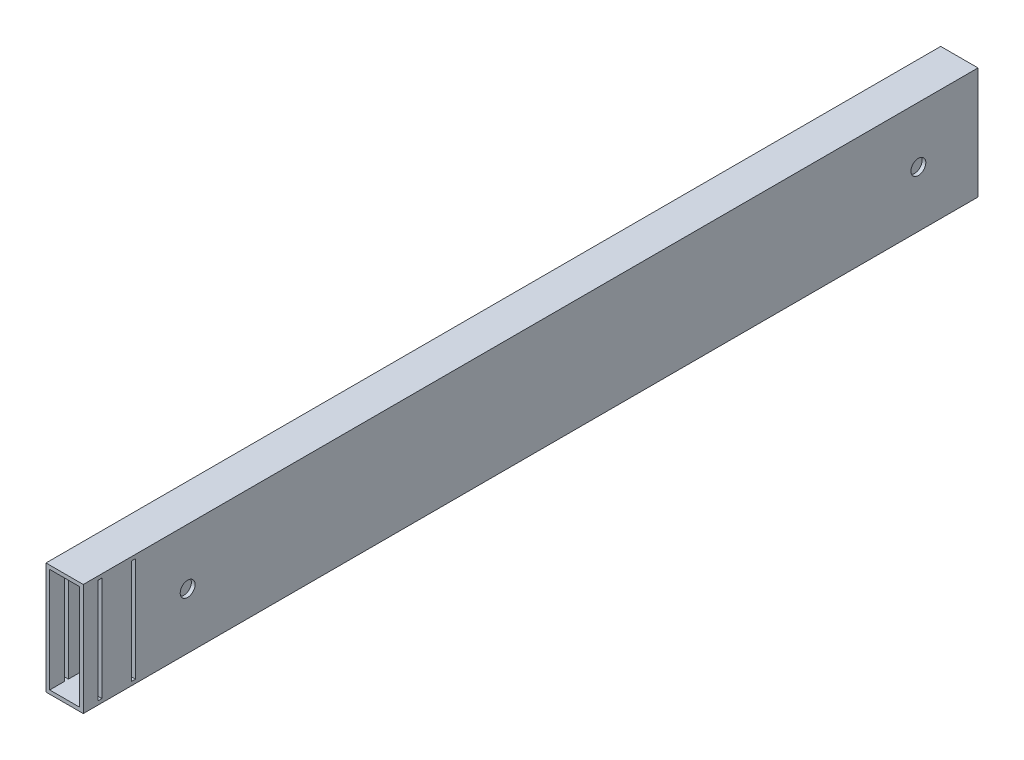
from build123d import *

# Parameters (mm, degrees)
SKETCH1_W           = 50
SKETCH1_H           = 1200
BOSS_EXTRUDE1_DEPTH = 150
CUT_EXTRUDE4_DEPTH  = 1216.781641579
SKETCH18_W          = 5
SKETCH18_H          = 140
CUT_EXTRUDE6_DEPTH  = 944.345111823
SKETCH19_W          = 5
SKETCH19_H          = 140
CUT_EXTRUDE7_DEPTH  = 944.345111823
SKETCH20_R          = 10
CUT_EXTRUDE8_DEPTH  = 944.345111823


with BuildPart() as part:
    # Sketch1 → Boss-Extrude1 (new body)
    with BuildSketch(Plane(origin=(0, 0, 0), x_dir=(1, 0, 0), z_dir=(0, 1, 0))):
        with Locations((-100, 330)):
            Rectangle(SKETCH1_W, SKETCH1_H)
    extrude(amount=BOSS_EXTRUDE1_DEPTH)

    # Sketch16 → Cut-Extrude4 (cut, through all)
    with BuildSketch(Plane.XY.offset(270)):
        Polygon((-100, 5), (-120, 5), (-120, 145), (-80, 145), (-80, 5), align=None)
    extrude(amount=-CUT_EXTRUDE4_DEPTH, mode=Mode.SUBTRACT)

    # Sketch18 → Cut-Extrude6 (cut, through all)
    with BuildSketch(Plane(origin=(-75, 0, 0), x_dir=(0, 0, -1), z_dir=(1, 0, 0))):
        with Locations((-247.5, 75)):
            Rectangle(SKETCH18_W, SKETCH18_H)
    extrude(amount=-CUT_EXTRUDE6_DEPTH, mode=Mode.SUBTRACT)

    # Sketch19 → Cut-Extrude7 (cut, through all)
    with BuildSketch(Plane(origin=(-75, 0, 0), x_dir=(0, 0, -1), z_dir=(1, 0, 0))):
        with Locations((-202.5, 75)):
            Rectangle(SKETCH19_W, SKETCH19_H)
    extrude(amount=-CUT_EXTRUDE7_DEPTH, mode=Mode.SUBTRACT)

    # Sketch20 → Cut-Extrude8 (cut, through all)
    with BuildSketch(Plane(origin=(-75, 0, 0), x_dir=(0, 0, -1), z_dir=(1, 0, 0))):
        with Locations((-130, 75)):
            Circle(SKETCH20_R)
        with Locations((850, 75)):
            Circle(SKETCH20_R)
    extrude(amount=-CUT_EXTRUDE8_DEPTH, mode=Mode.SUBTRACT)


solid = part.part
